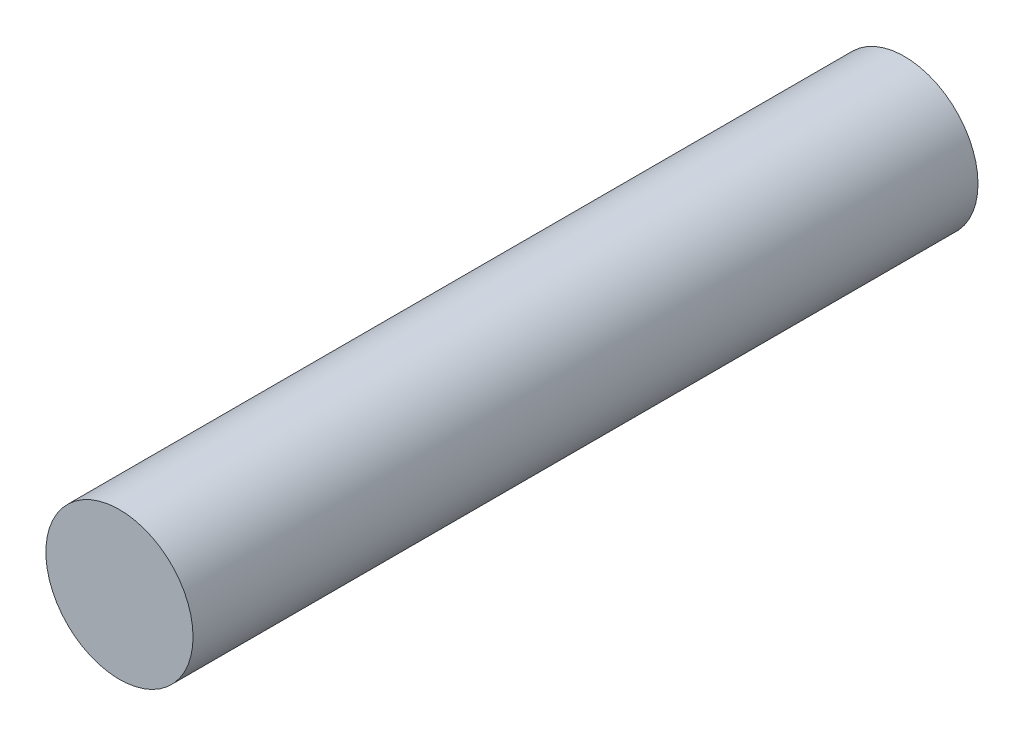
from build123d import *

# Parameters (mm, degrees)
SKETCH1_R           = 4.7625
BOSS_EXTRUDE1_DEPTH = 50.8


with BuildPart() as part:
    # Sketch1 → Boss-Extrude1 (new body)
    with BuildSketch(Plane.XY):
        Circle(SKETCH1_R)
    extrude(amount=-BOSS_EXTRUDE1_DEPTH)


solid = part.part
